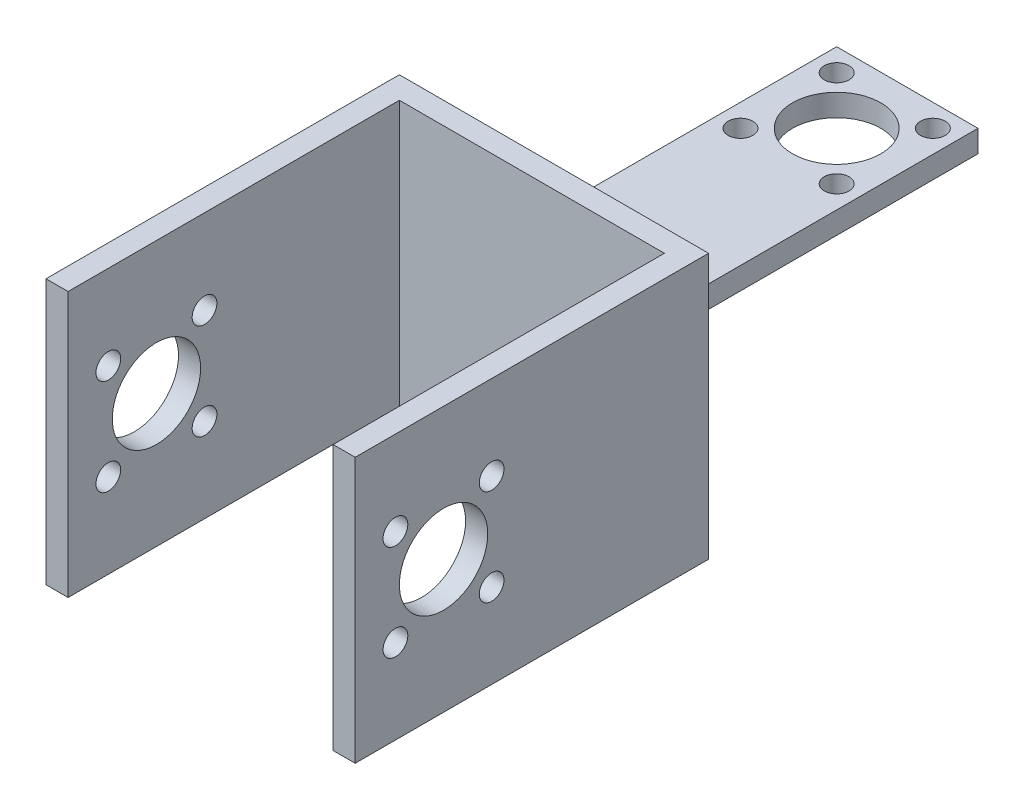
from build123d import *

# Parameters (mm, degrees)
BOSS_EXTRUDE1_DEPTH = 19.05
SKETCH3_W           = 20.32
SKETCH3_H           = 50.8
CUT_EXTRUDE1_DEPTH  = 19.05
SKETCH4_W           = 20.32
SKETCH4_H           = 50.8
CUT_EXTRUDE2_DEPTH  = 15.875
CUT_EXTRUDE3_REACH  = 110.928
SKETCH6_R           = 6.35
SKETCH6_R_2         = 1.778
CUT_EXTRUDE6_REACH  = 114.522
SKETCH9_R           = 6.35
SKETCH9_R_2         = 1.778


with BuildPart() as part:
    # Sketch1 → Boss-Extrude1 (new, symmetric)
    with BuildSketch(Plane(origin=(0, 0, 0), x_dir=(1, 0, 0), z_dir=(0, 1, 0))):
        Polygon((0, 0), (-20.32, 0), (-20.32, -50.8), (-32.385, -50.8), (-32.385, -101.6), (-29.21, -101.6), (-29.21, -53.975), (8.89, -53.975), (8.89, -101.6), (12.065, -101.6), (12.065, -50.8), (0, -50.8), align=None)
    extrude(amount=BOSS_EXTRUDE1_DEPTH, both=True)

    # Sketch3 → Cut-Extrude1 (cut)
    with BuildSketch(Plane.XZ.offset(19.05)):
        with Locations((-10.16, 25.4)):
            Rectangle(SKETCH3_W, SKETCH3_H)
    extrude(amount=-CUT_EXTRUDE1_DEPTH, mode=Mode.SUBTRACT)

    # Sketch4 → Cut-Extrude2 (cut)
    with BuildSketch(Plane(origin=(0, 19.05, 0), x_dir=(1, 0, 0), z_dir=(0, 1, 0))):
        with Locations((-10.16, -25.4)):
            Rectangle(SKETCH4_W, SKETCH4_H)
    extrude(amount=-CUT_EXTRUDE2_DEPTH, mode=Mode.SUBTRACT)

    # Sketch6 → Cut-Extrude3 (cut, up to next)
    with BuildSketch(Plane(origin=(0, 3.175, 0), x_dir=(1, 0, 0), z_dir=(0, 1, 0)), mode=Mode.PRIVATE) as cut_extrude3_sk1:
        with Locations(Location((-10.16, -10.16, 0), (0, 0, 270))):
            Circle(SKETCH6_R)
    cut_extrude3_tool1 = extrude(cut_extrude3_sk1.sketch, amount=-CUT_EXTRUDE3_REACH, mode=Mode.PRIVATE) & part.part
    # Sketch6 → Cut-Extrude3 (cut, up to next)
    with BuildSketch(Plane(origin=(0, 3.175, 0), x_dir=(1, 0, 0), z_dir=(0, 1, 0)), mode=Mode.PRIVATE) as cut_extrude3_sk2:
        with Locations(Location((-17.074797213, -17.074797213, 0), (0, 0, 270))):
            Circle(SKETCH6_R_2)
    cut_extrude3_tool2 = extrude(cut_extrude3_sk2.sketch, amount=-CUT_EXTRUDE3_REACH, mode=Mode.PRIVATE) & part.part
    # Sketch6 → Cut-Extrude3 (cut, up to next)
    with BuildSketch(Plane(origin=(0, 3.175, 0), x_dir=(1, 0, 0), z_dir=(0, 1, 0)), mode=Mode.PRIVATE) as cut_extrude3_sk3:
        with Locations(Location((-17.074797213, -3.245202787, 0), (0, 0, 270))):
            Circle(SKETCH6_R_2)
    cut_extrude3_tool3 = extrude(cut_extrude3_sk3.sketch, amount=-CUT_EXTRUDE3_REACH, mode=Mode.PRIVATE) & part.part
    # Sketch6 → Cut-Extrude3 (cut, up to next)
    with BuildSketch(Plane(origin=(0, 3.175, 0), x_dir=(1, 0, 0), z_dir=(0, 1, 0)), mode=Mode.PRIVATE) as cut_extrude3_sk4:
        with Locations(Location((-3.245202787, -3.245202787, 0), (0, 0, 270))):
            Circle(SKETCH6_R_2)
    cut_extrude3_tool4 = extrude(cut_extrude3_sk4.sketch, amount=-CUT_EXTRUDE3_REACH, mode=Mode.PRIVATE) & part.part
    # Sketch6 → Cut-Extrude3 (cut, up to next)
    with BuildSketch(Plane(origin=(0, 3.175, 0), x_dir=(1, 0, 0), z_dir=(0, 1, 0)), mode=Mode.PRIVATE) as cut_extrude3_sk5:
        with Locations(Location((-3.245202787, -17.074797213, 0), (0, 0, 270))):
            Circle(SKETCH6_R_2)
    cut_extrude3_tool5 = extrude(cut_extrude3_sk5.sketch, amount=-CUT_EXTRUDE3_REACH, mode=Mode.PRIVATE) & part.part
    add(cut_extrude3_tool1.solids().sort_by_distance((-10.16, 3.175, 10.16))[0], mode=Mode.SUBTRACT)
    add(cut_extrude3_tool2.solids().sort_by_distance((-17.074797, 3.175, 17.074797))[0], mode=Mode.SUBTRACT)
    add(cut_extrude3_tool3.solids().sort_by_distance((-17.074797, 3.175, 3.245203))[0], mode=Mode.SUBTRACT)
    add(cut_extrude3_tool4.solids().sort_by_distance((-3.245203, 3.175, 3.245203))[0], mode=Mode.SUBTRACT)
    add(cut_extrude3_tool5.solids().sort_by_distance((-3.245203, 3.175, 17.074797))[0], mode=Mode.SUBTRACT)

    # Cut-Extrude6: up to this face of the body (flat: up to its plane)
    cut_extrude6_end = Plane(part.part.faces().sort_by_distance((-32.385, 0, 76.2))[0])
    # Sketch9 → Cut-Extrude6 (cut, up to the picked face)
    with BuildSketch(Plane(origin=(12.065, 0, 0), x_dir=(0, 0, -1), z_dir=(1, 0, 0)), mode=Mode.PRIVATE) as cut_extrude6_sk1:
        with Locations((-88.9, 0)):
            Circle(SKETCH9_R)
    cut_extrude6_tool1 = split(extrude(cut_extrude6_sk1.sketch, amount=-CUT_EXTRUDE6_REACH, mode=Mode.PRIVATE), bisect_by=cut_extrude6_end, keep=Keep.BOTH, mode=Mode.PRIVATE)
    # Sketch9 → Cut-Extrude6 (cut, up to the picked face)
    with BuildSketch(Plane(origin=(12.065, 0, 0), x_dir=(0, 0, -1), z_dir=(1, 0, 0)), mode=Mode.PRIVATE) as cut_extrude6_sk2:
        with Locations((-95.814797213, 6.914797213)):
            Circle(SKETCH9_R_2)
    cut_extrude6_tool2 = split(extrude(cut_extrude6_sk2.sketch, amount=-CUT_EXTRUDE6_REACH, mode=Mode.PRIVATE), bisect_by=cut_extrude6_end, keep=Keep.BOTH, mode=Mode.PRIVATE)
    # Sketch9 → Cut-Extrude6 (cut, up to the picked face)
    with BuildSketch(Plane(origin=(12.065, 0, 0), x_dir=(0, 0, -1), z_dir=(1, 0, 0)), mode=Mode.PRIVATE) as cut_extrude6_sk3:
        with Locations((-81.985202787, 6.914797213)):
            Circle(SKETCH9_R_2)
    cut_extrude6_tool3 = split(extrude(cut_extrude6_sk3.sketch, amount=-CUT_EXTRUDE6_REACH, mode=Mode.PRIVATE), bisect_by=cut_extrude6_end, keep=Keep.BOTH, mode=Mode.PRIVATE)
    # Sketch9 → Cut-Extrude6 (cut, up to the picked face)
    with BuildSketch(Plane(origin=(12.065, 0, 0), x_dir=(0, 0, -1), z_dir=(1, 0, 0)), mode=Mode.PRIVATE) as cut_extrude6_sk4:
        with Locations((-81.985202787, -6.914797213)):
            Circle(SKETCH9_R_2)
    cut_extrude6_tool4 = split(extrude(cut_extrude6_sk4.sketch, amount=-CUT_EXTRUDE6_REACH, mode=Mode.PRIVATE), bisect_by=cut_extrude6_end, keep=Keep.BOTH, mode=Mode.PRIVATE)
    # Sketch9 → Cut-Extrude6 (cut, up to the picked face)
    with BuildSketch(Plane(origin=(12.065, 0, 0), x_dir=(0, 0, -1), z_dir=(1, 0, 0)), mode=Mode.PRIVATE) as cut_extrude6_sk5:
        with Locations((-95.814797213, -6.914797213)):
            Circle(SKETCH9_R_2)
    cut_extrude6_tool5 = split(extrude(cut_extrude6_sk5.sketch, amount=-CUT_EXTRUDE6_REACH, mode=Mode.PRIVATE), bisect_by=cut_extrude6_end, keep=Keep.BOTH, mode=Mode.PRIVATE)
    add(cut_extrude6_tool1.solids().sort_by(Axis((12.065, 0, 88.9), (-1, 0, 0)))[0], mode=Mode.SUBTRACT)
    add(cut_extrude6_tool2.solids().sort_by(Axis((12.065, 6.914797, 95.814797), (-1, 0, 0)))[0], mode=Mode.SUBTRACT)
    add(cut_extrude6_tool3.solids().sort_by(Axis((12.065, 6.914797, 81.985203), (-1, 0, 0)))[0], mode=Mode.SUBTRACT)
    add(cut_extrude6_tool4.solids().sort_by(Axis((12.065, -6.914797, 81.985203), (-1, 0, 0)))[0], mode=Mode.SUBTRACT)
    add(cut_extrude6_tool5.solids().sort_by(Axis((12.065, -6.914797, 95.814797), (-1, 0, 0)))[0], mode=Mode.SUBTRACT)


solid = part.part
